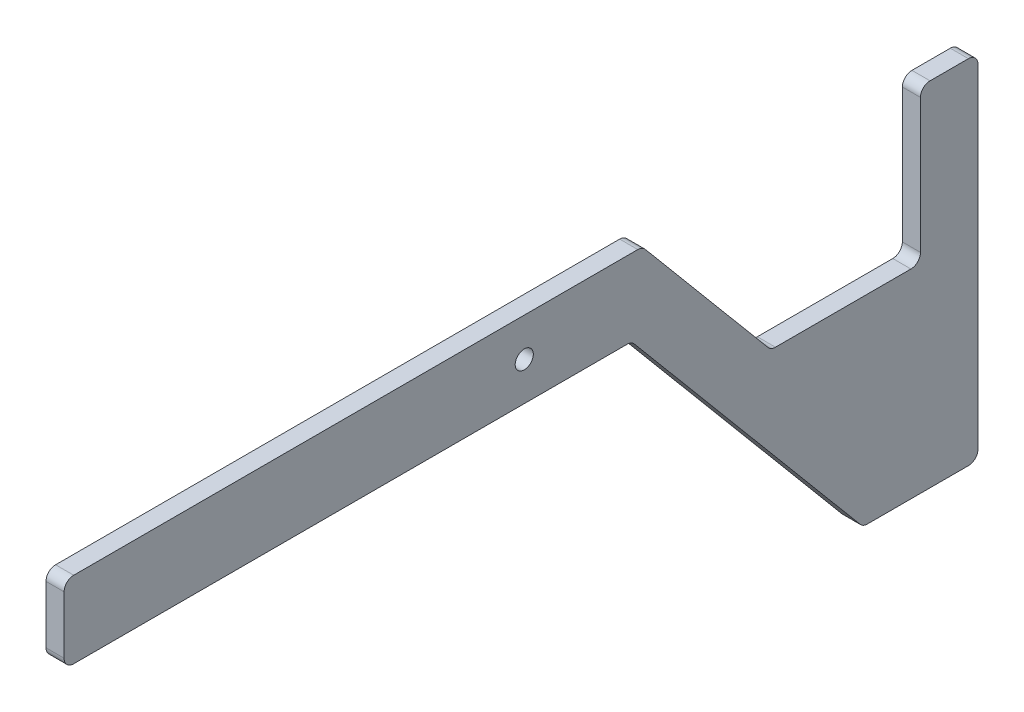
from build123d import *

# Parameters (mm, degrees)
SKETCH1_R           = 1.5
BOSS_EXTRUDE1_DEPTH = 1.5
FILLET1_R           = 1.5875


with BuildPart() as part:
    # Sketch1 → Boss-Extrude1 (new, symmetric)
    with BuildSketch(Plane(origin=(0, 0, 0), x_dir=(0, 0, -1), z_dir=(1, 0, 0))):
        Polygon((-75.668068816, 16.486293283), (-75.668068816, 29.186293283), (20.071657388, 29.186293283), (41.38478802, 3.786293283), (66.143068816, 3.786293283), (66.143068816, 29.186293283), (75.668068816, 29.186293283), (75.668068816, -29.186293283), (56.618068816, -29.186293283), (18.294218273, 16.486293283), align=None)
        with Locations((0.531931184, 22.836293283)):
            Circle(SKETCH1_R, mode=Mode.SUBTRACT)
    extrude(amount=BOSS_EXTRUDE1_DEPTH, both=True)

    # Fillet1
    fillet1_edges = [part.edges().sort_by_distance(p)[0] for p in [
        (0, 29.186293283, -20.071657388),
        (0, 3.786293283, -41.38478802),
        (0, 3.786293283, -66.143068816),
        (0, 29.186293283, -66.143068816),
        (0, 29.186293283, -75.668068816),
        (0, -29.186293283, -75.668068816),
        (0, -29.186293283, -56.618068816),
        (0, 16.486293283, -18.294218273),
        (0, 16.486293283, 75.668068816),
        (0, 29.186293283, 75.668068816),
    ]]
    fillet(fillet1_edges, radius=FILLET1_R)


solid = part.part
